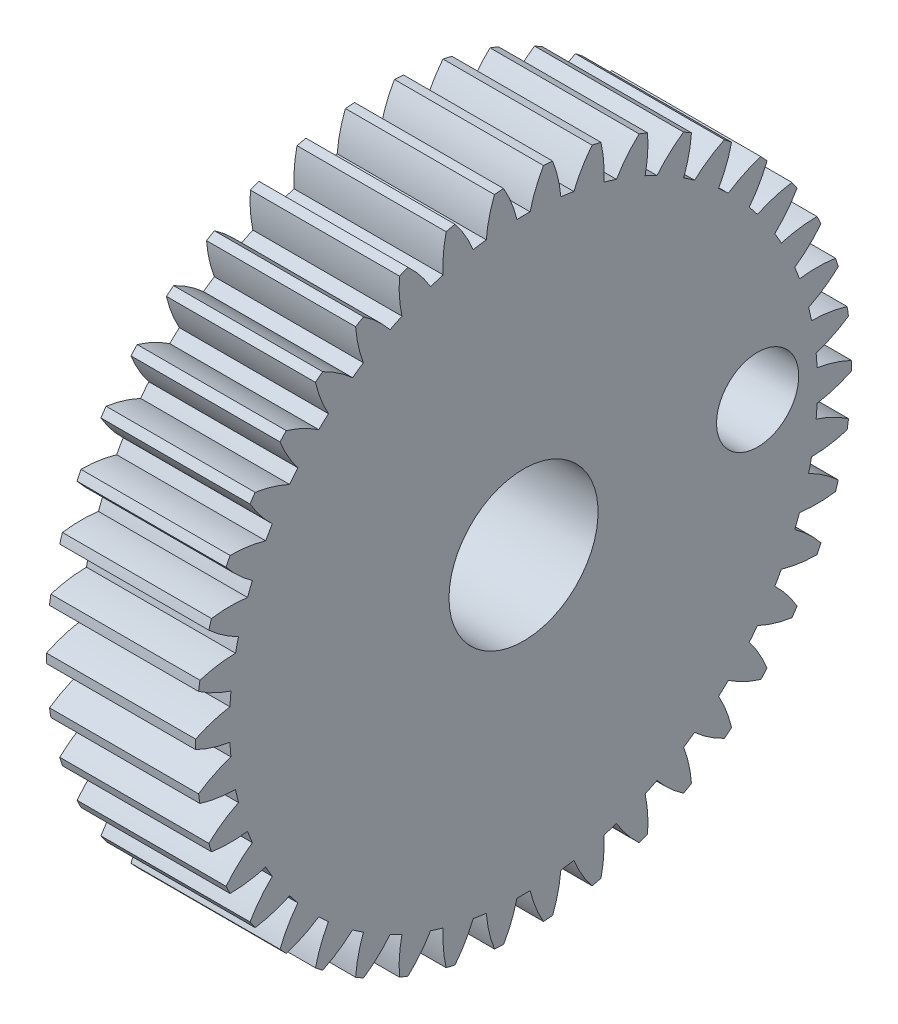
from build123d import *

# Parameters (mm, degrees)
BASPROSKE_W        = 6.35
BASPROSKE_H        = 13.97
TOOTHCUT_DEPTH     = 21.751970991
TEETHCUTS_COUNT    = 42
TEETHCUTS_ANGLE    = 351.428571429
BORSKE_R           = 3.175
BORE_DEPTH         = 50.8000508
SKETCH1_R          = 1.75
CUT_EXTRUDE1_DEPTH = 21.734568149


with BuildPart() as part:
    # BasProSke → Base-Revolve (revolve)
    with BuildSketch(Plane(origin=(0, 0, 0), x_dir=(1, 0, 0), z_dir=(0, 1, 0)), mode=Mode.PRIVATE) as base_revolve_sk:
        with Locations((3.175, 6.985)):
            Rectangle(BASPROSKE_W, BASPROSKE_H)
    revolve(base_revolve_sk.sketch.rotate(Axis((-10, 0, 0), (1, 0, 0)), 180), axis=Axis((-10, 0, 0), (1, 0, 0)))

    # TooCutSke → ToothCut (cut, through all)
    with BuildSketch(Plane(origin=(0, 0, 0), x_dir=(0, 0, -1), z_dir=(1, 0, 0))):
        with BuildLine():
            ThreePointArc((0.280922427, 12.519048503), (0, 12.5222), (-0.280922427, 12.519048503))
            ThreePointArc((-0.280922427, 12.519048503), (-0.519083904, 13.265343066), (-0.86398515, 13.968706126))
            ThreePointArc((-0.86398515, 13.968706126), (0, 13.9954), (0.86398515, 13.968706126))
            ThreePointArc((0.86398515, 13.968706126), (0.519083904, 13.265343066), (0.280922427, 12.519048503))
        make_face()
    toothcut = extrude(amount=TOOTHCUT_DEPTH, mode=Mode.SUBTRACT)

    # TeethCuts: ToothCut ×42 about axis
    teethcuts_axis = Axis((-10, 0, 0), (1, 0, 0))
    for i in range(1, TEETHCUTS_COUNT):
        add(toothcut.rotate(teethcuts_axis, i * TEETHCUTS_ANGLE / (TEETHCUTS_COUNT - 1)), mode=Mode.SUBTRACT)

    # BorSke → Bore (cut, symmetric)
    with BuildSketch(Plane(origin=(0, 0, 0), x_dir=(0, 0, -1), z_dir=(1, 0, 0))):
        with Locations(Location((0, 0, 0), (0, 0, 180))):
            Circle(BORSKE_R)
    extrude(amount=BORE_DEPTH, both=True, mode=Mode.SUBTRACT)

    # Sketch1 → Cut-Extrude1 (cut, through all)
    with BuildSketch(Plane(origin=(6.35, 0, 0), x_dir=(0, 0, -1), z_dir=(1, 0, 0))):
        with Locations((9.972037972, 0.747300936)):
            Circle(SKETCH1_R)
    extrude(amount=-CUT_EXTRUDE1_DEPTH, mode=Mode.SUBTRACT)


solid = part.part
